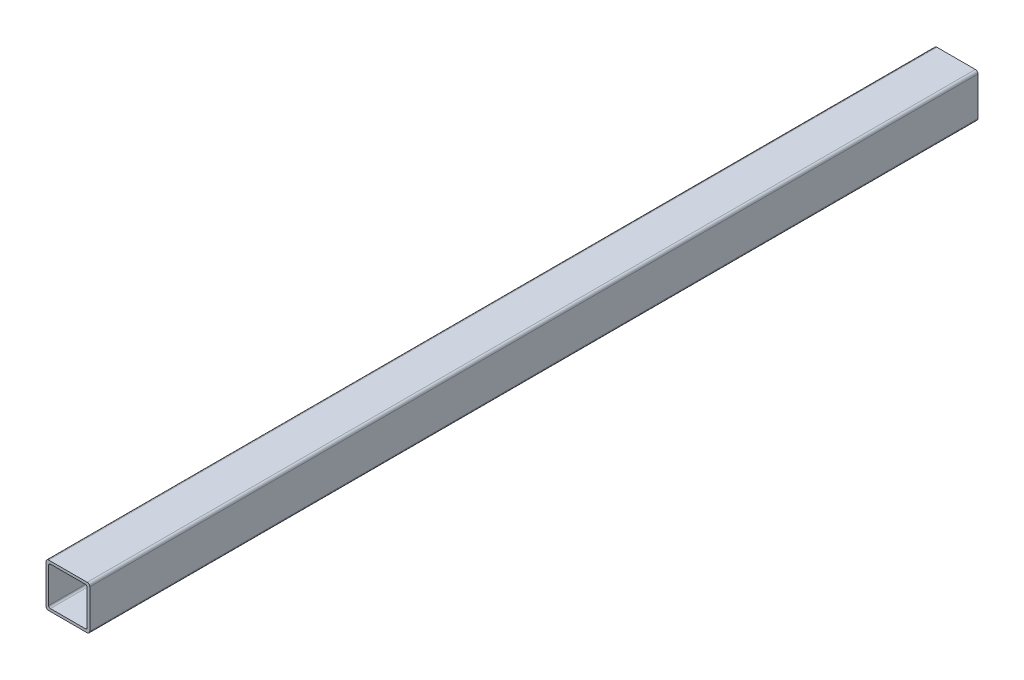
from build123d import *

# Parameters (mm, degrees)
EXTRUDE_1_DEPTH = 1015


with BuildPart() as part:
    # Эскиз1 → Бобышка-Вытянуть1 (new body)
    with BuildSketch(Plane.XY):
        with BuildLine():
            Line((-22, 25), (22, 25))
            ThreePointArc((22, 25), (24.121320344, 24.121320344), (25, 22))
            Line((25, 22), (25, -22))
            ThreePointArc((25, -22), (24.121320344, -24.121320344), (22, -25))
            Line((22, -25), (-22, -25))
            ThreePointArc((-22, -25), (-24.121320344, -24.121320344), (-25, -22))
            Line((-25, -22), (-25, 22))
            ThreePointArc((-25, 22), (-24.121320344, 24.121320344), (-22, 25))
        make_face()
        with BuildLine():
            Line((-20, 22), (20, 22))
            ThreePointArc((20, 22), (21.414213562, 21.414213562), (22, 20))
            Line((22, 20), (22, -20))
            ThreePointArc((22, -20), (21.414213562, -21.414213562), (20, -22))
            Line((20, -22), (-20, -22))
            ThreePointArc((-20, -22), (-21.414213562, -21.414213562), (-22, -20))
            Line((-22, -20), (-22, 20))
            ThreePointArc((-22, 20), (-21.414213562, 21.414213562), (-20, 22))
        make_face(mode=Mode.SUBTRACT)
    extrude(amount=-EXTRUDE_1_DEPTH)


solid = part.part
